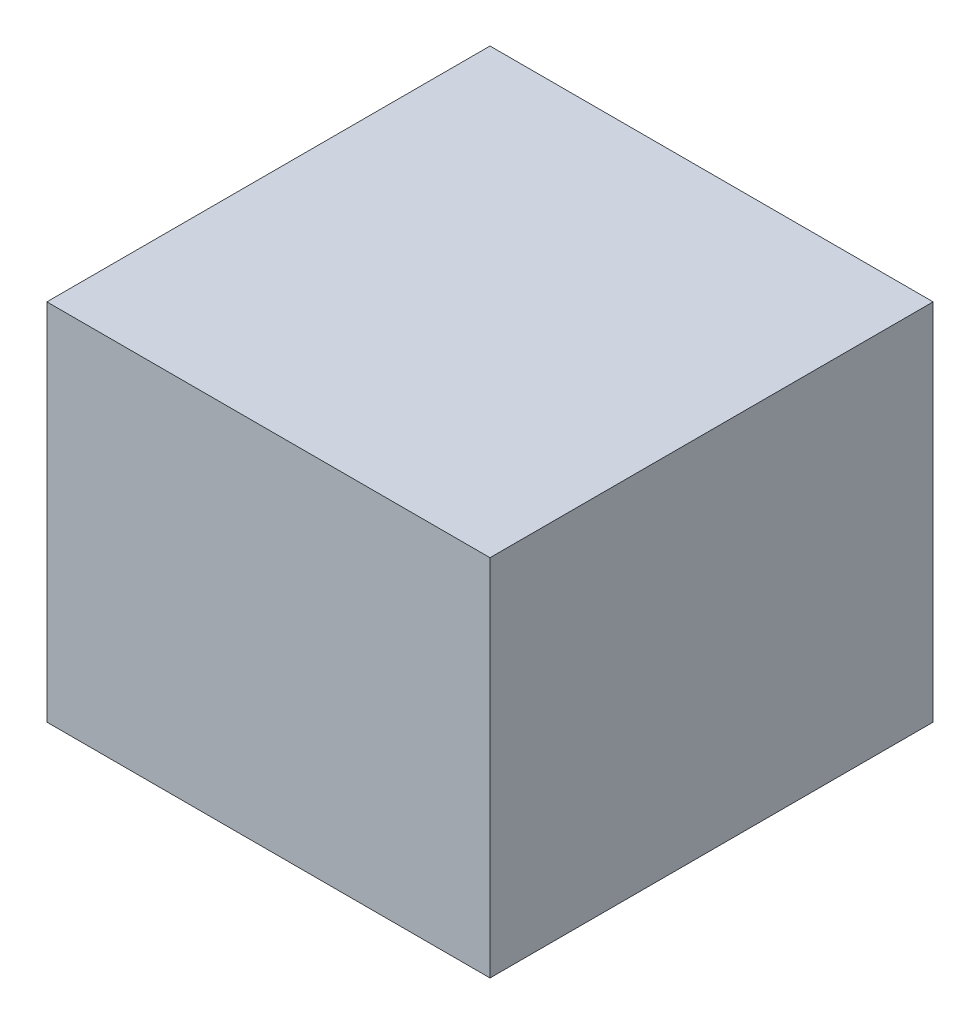
from build123d import *

# Parameters (mm, degrees)
SKETCH_1_W      = 140
SKETCH_1_H      = 140
EXTRUDE_1_DEPTH = 57.5


with BuildPart() as part:
    # 草图1 → 凸台-拉伸1 (new, symmetric)
    with BuildSketch(Plane(origin=(0, 0, 0), x_dir=(1, 0, 0), z_dir=(0, 1, 0))):
        Rectangle(SKETCH_1_W, SKETCH_1_H)
    extrude(amount=EXTRUDE_1_DEPTH, both=True)


solid = part.part
